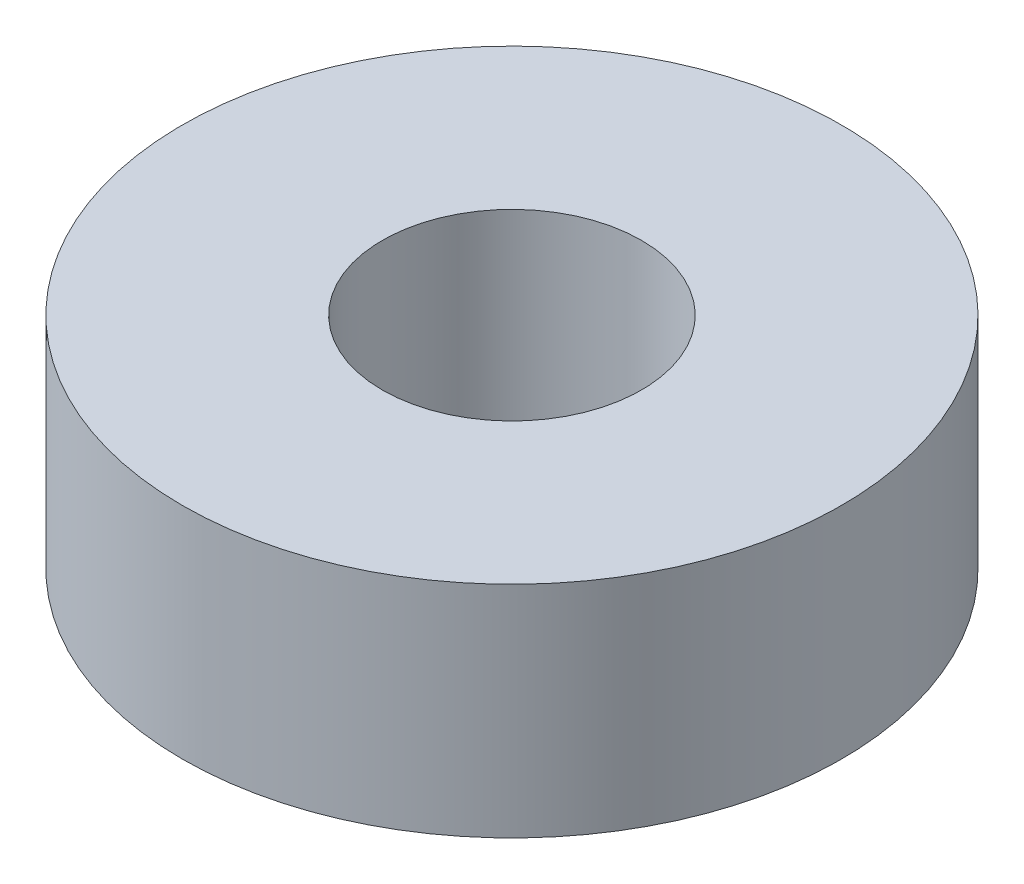
from build123d import *

# Parameters (mm, degrees)
SKETCH1_R           = 7.5
SKETCH1_R_2         = 2.95
BOSS_EXTRUDE1_DEPTH = 5


with BuildPart() as part:
    # Sketch1 → Boss-Extrude1 (new body)
    with BuildSketch(Plane(origin=(0, 0, 0), x_dir=(1, 0, 0), z_dir=(0, 1, 0))):
        with Locations(Location((0, 0, 0), (0, 0, 270))):
            Circle(SKETCH1_R)
        with Locations(Location((0, 0, 0), (0, 0, 270))):
            Circle(SKETCH1_R_2, mode=Mode.SUBTRACT)
    extrude(amount=BOSS_EXTRUDE1_DEPTH)


solid = part.part
